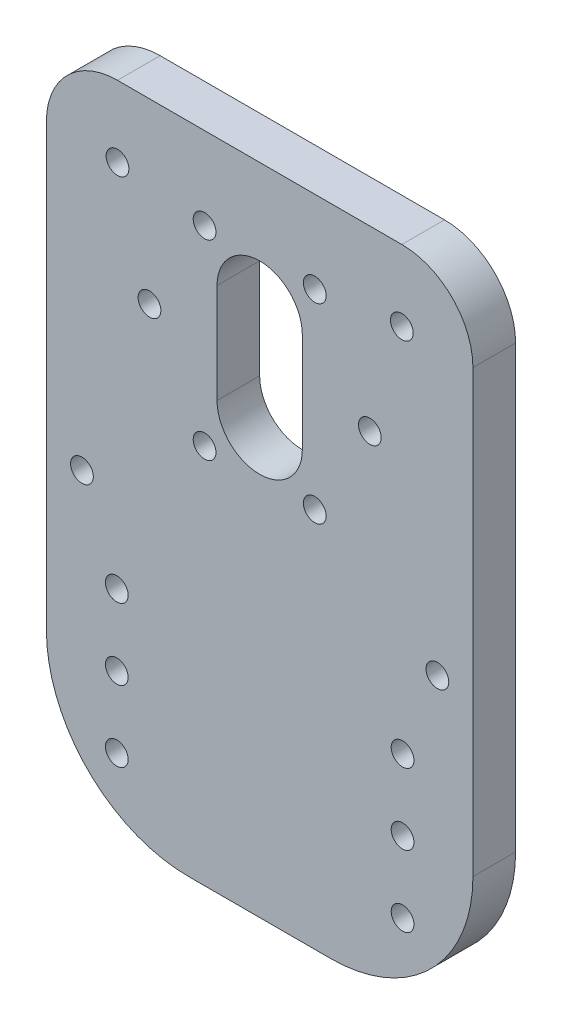
from build123d import *

# Parameters (mm, degrees)
SKETCH_1_W          = 60
SKETCH_1_H          = 120
SKETCH_1_R          = 1.6
SKETCH_1_R_2        = 2.15
EXTRUDE_3_DEPTH     = 6
SKETCH_9_R          = 1.6
CUT_EXTRUDE_1_DEPTH = 6
FILLET_1_R          = 10
SKETCH_11_R         = 2.15
CUT_EXTRUDE_2_DEPTH = 6
FILLET_2_R          = 20
SKETCH_12_R         = 1.6
CUT_EXTRUDE_3_DEPTH = 10
SKETCH_13_R         = 1.6
CUT_EXTRUDE_4_DEPTH = 10
EXTRUDE_START       = -6
SKETCH_14_R         = 1.6
EXTRUDE_5_DEPTH     = 6


with BuildPart() as part:
    # 草图1 → 凸台-拉伸3 (new body)
    with BuildSketch(Plane.XY):
        Rectangle(SKETCH_1_W, SKETCH_1_H)
        with Locations((0, 50.5)):
            Circle(SKETCH_1_R, mode=Mode.SUBTRACT)
        with Locations((20, -50)):
            Circle(SKETCH_1_R_2, mode=Mode.SUBTRACT)
        with Locations((-20, -50)):
            Circle(SKETCH_1_R_2, mode=Mode.SUBTRACT)
        with Locations((13.423393759, 42.75)):
            Circle(SKETCH_1_R, mode=Mode.SUBTRACT)
        with Locations((13.423393759, 27.25)):
            Circle(SKETCH_1_R, mode=Mode.SUBTRACT)
        with Locations((0, 19.5)):
            Circle(SKETCH_1_R, mode=Mode.SUBTRACT)
        with Locations((-13.423393759, 27.25)):
            Circle(SKETCH_1_R, mode=Mode.SUBTRACT)
        with Locations((-13.423393759, 42.75)):
            Circle(SKETCH_1_R, mode=Mode.SUBTRACT)
        with BuildLine():
            Line((6, 42), (6, 28))
            ThreePointArc((6, 28), (0, 22), (-6, 28))
            Line((-6, 28), (-6, 42))
            ThreePointArc((-6, 42), (0, 48), (6, 42))
        make_face(mode=Mode.SUBTRACT)
    extrude(amount=EXTRUDE_3_DEPTH)

    # 草图9 → 切除-拉伸1 (cut)
    with BuildSketch(Plane.XY.offset(6)):
        with Locations((20.1, -22)):
            Circle(SKETCH_9_R)
        with Locations((20.1, -2)):
            Circle(SKETCH_9_R)
        with Locations((20.1, -12)):
            Circle(SKETCH_9_R)
        with Locations((-20.1, -2)):
            Circle(SKETCH_9_R)
        with Locations((-20.1, -12)):
            Circle(SKETCH_9_R)
        with Locations((-20.1, -22)):
            Circle(SKETCH_9_R)
    extrude(amount=-CUT_EXTRUDE_1_DEPTH, mode=Mode.SUBTRACT)

    # 圆角1
    fillet_1_edges = [part.edges().sort_by_distance(p)[0] for p in [
        (30, -60, 3),
        (-30, -60, 3),
        (-30, 60, 3),
        (30, 60, 3),
    ]]
    fillet(fillet_1_edges, radius=FILLET_1_R)

    # 草图11 → 切除-拉伸2 (cut)
    with BuildSketch(Plane.XY.offset(6)):
        with BuildLine():
            Line((30, -32), (-30, -32))
            Line((-30, -32), (-30, -50))
            ThreePointArc((-30, -50), (-27.071067812, -57.071067812), (-20, -60))
            Line((-20, -60), (20, -60))
            ThreePointArc((20, -60), (27.071067812, -57.071067812), (30, -50))
            Line((30, -50), (30, -32))
        make_face()
        with Locations((-20, -50)):
            Circle(SKETCH_11_R, mode=Mode.SUBTRACT)
        with Locations((20, -50)):
            Circle(SKETCH_11_R, mode=Mode.SUBTRACT)
    extrude(amount=-CUT_EXTRUDE_2_DEPTH, mode=Mode.SUBTRACT)

    # 圆角2
    fillet_2_edges = [part.edges().sort_by_distance(p)[0] for p in [
        (-30, -32, 3),
        (30, -32, 3),
    ]]
    fillet(fillet_2_edges, radius=FILLET_2_R)

    # 草图12 → 切除-拉伸3 (cut)
    with BuildSketch(Plane(origin=(0, 0, 0), x_dir=(-1, 0, 0), z_dir=(0, 0, -1))):
        with Locations((-20, 50)):
            Circle(SKETCH_12_R)
        with Locations((20, 50)):
            Circle(SKETCH_12_R)
        with Locations((25, 10)):
            Circle(SKETCH_12_R)
        with Locations((-25, 10)):
            Circle(SKETCH_12_R)
    extrude(amount=-CUT_EXTRUDE_3_DEPTH, mode=Mode.SUBTRACT)

    # 草图13 → 切除-拉伸4 (cut)
    with BuildSketch(Plane.XY.offset(6)):
        with Locations((-15.5, 35)):
            Circle(SKETCH_13_R)
        with Locations((-7.75, 48.423393759)):
            Circle(SKETCH_13_R)
        with Locations((7.75, 48.423393759)):
            Circle(SKETCH_13_R)
        with Locations((15.5, 35)):
            Circle(SKETCH_13_R)
        with Locations((7.75, 21.576606241)):
            Circle(SKETCH_13_R)
        with Locations((-7.75, 21.576606241)):
            Circle(SKETCH_13_R)
    extrude(amount=-CUT_EXTRUDE_4_DEPTH, mode=Mode.SUBTRACT)

    # 草图14 → 凸台-拉伸5 (add)
    with BuildSketch(Plane.XY.offset(6).offset(EXTRUDE_START)):
        with Locations((0, 50.5)):
            Circle(SKETCH_14_R)
        with Locations((13.423393759, 42.75)):
            Circle(SKETCH_14_R)
        with Locations((13.423393759, 27.25)):
            Circle(SKETCH_14_R)
        with Locations((0, 19.5)):
            Circle(SKETCH_14_R)
        with Locations((-13.423393759, 27.25)):
            Circle(SKETCH_14_R)
        with Locations((-13.423393759, 42.75)):
            Circle(SKETCH_14_R)
    extrude(amount=EXTRUDE_5_DEPTH)


solid = part.part
